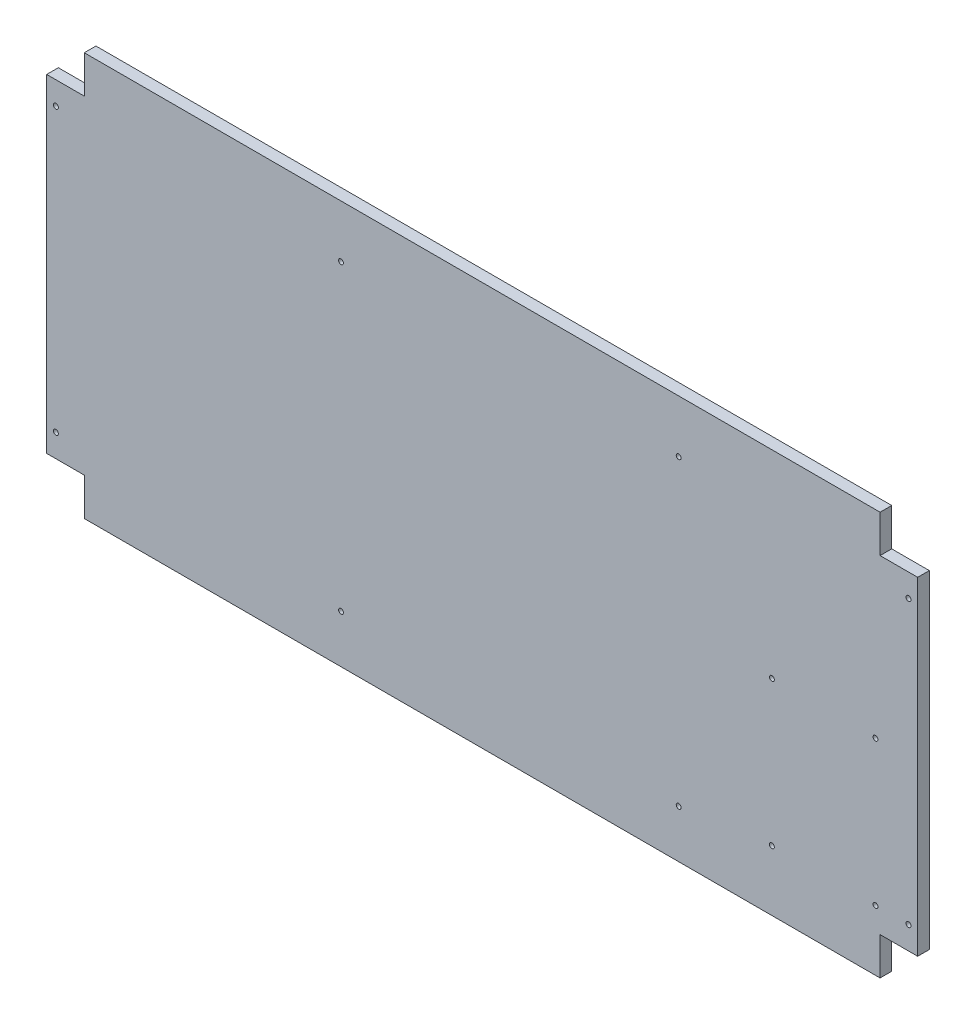
from build123d import *

# Parameters (mm, degrees)
SKETCH2_W           = 950
SKETCH2_H           = 440
BOSS_EXTRUDE1_DEPTH = 12.7
CUT_EXTRUDE1_REACH  = 525.628
SKETCH3_W           = 41
SKETCH3_H           = 41
CUT_EXTRUDE2_REACH  = 525.628
SKETCH4_R           = 2.75
CUT_EXTRUDE3_REACH  = 525.628
SKETCH6_R           = 2.665
CUT_EXTRUDE4_REACH  = 525.628
SKETCH7_R           = 2.665


with BuildPart() as part:
    # Sketch2 → Boss-Extrude1 (new body)
    with BuildSketch(Plane.XY):
        Rectangle(SKETCH2_W, SKETCH2_H)
    extrude(amount=BOSS_EXTRUDE1_DEPTH)

    # Sketch3 → Cut-Extrude1 (cut, up to next)
    with BuildSketch(Plane.XY.offset(12.7), mode=Mode.PRIVATE) as cut_extrude1_sk1:
        with Locations((-454.5, 199.5)):
            Rectangle(SKETCH3_W, SKETCH3_H)
    cut_extrude1_tool1 = extrude(cut_extrude1_sk1.sketch, amount=-CUT_EXTRUDE1_REACH, mode=Mode.PRIVATE) & part.part
    # Sketch3 → Cut-Extrude1 (cut, up to next)
    with BuildSketch(Plane.XY.offset(12.7), mode=Mode.PRIVATE) as cut_extrude1_sk2:
        with Locations((454.5, 199.5)):
            Rectangle(SKETCH3_W, SKETCH3_H)
    cut_extrude1_tool2 = extrude(cut_extrude1_sk2.sketch, amount=-CUT_EXTRUDE1_REACH, mode=Mode.PRIVATE) & part.part
    # Sketch3 → Cut-Extrude1 (cut, up to next)
    with BuildSketch(Plane.XY.offset(12.7), mode=Mode.PRIVATE) as cut_extrude1_sk3:
        with Locations((454.5, -199.5)):
            Rectangle(SKETCH3_W, SKETCH3_H)
    cut_extrude1_tool3 = extrude(cut_extrude1_sk3.sketch, amount=-CUT_EXTRUDE1_REACH, mode=Mode.PRIVATE) & part.part
    # Sketch3 → Cut-Extrude1 (cut, up to next)
    with BuildSketch(Plane.XY.offset(12.7), mode=Mode.PRIVATE) as cut_extrude1_sk4:
        with Locations((-454.5, -199.5)):
            Rectangle(SKETCH3_W, SKETCH3_H)
    cut_extrude1_tool4 = extrude(cut_extrude1_sk4.sketch, amount=-CUT_EXTRUDE1_REACH, mode=Mode.PRIVATE) & part.part
    add(cut_extrude1_tool1.solids().sort_by_distance((-454.5, 199.5, 12.7))[0], mode=Mode.SUBTRACT)
    add(cut_extrude1_tool2.solids().sort_by_distance((454.5, 199.5, 12.7))[0], mode=Mode.SUBTRACT)
    add(cut_extrude1_tool3.solids().sort_by_distance((454.5, -199.5, 12.7))[0], mode=Mode.SUBTRACT)
    add(cut_extrude1_tool4.solids().sort_by_distance((-454.5, -199.5, 12.7))[0], mode=Mode.SUBTRACT)

    # Sketch4 → Cut-Extrude2 (cut, up to next)
    with BuildSketch(Plane.XY.offset(12.7), mode=Mode.PRIVATE) as cut_extrude2_sk1:
        with Locations((-465, -154)):
            Circle(SKETCH4_R)
    cut_extrude2_tool1 = extrude(cut_extrude2_sk1.sketch, amount=-CUT_EXTRUDE2_REACH, mode=Mode.PRIVATE) & part.part
    # Sketch4 → Cut-Extrude2 (cut, up to next)
    with BuildSketch(Plane.XY.offset(12.7), mode=Mode.PRIVATE) as cut_extrude2_sk2:
        with Locations(Location((-465, 154, 0), (0, 0, 180))):
            Circle(SKETCH4_R)
    cut_extrude2_tool2 = extrude(cut_extrude2_sk2.sketch, amount=-CUT_EXTRUDE2_REACH, mode=Mode.PRIVATE) & part.part
    # Sketch4 → Cut-Extrude2 (cut, up to next)
    with BuildSketch(Plane.XY.offset(12.7), mode=Mode.PRIVATE) as cut_extrude2_sk3:
        with Locations(Location((465, -154, 0), (0, 0, 180))):
            Circle(SKETCH4_R)
    cut_extrude2_tool3 = extrude(cut_extrude2_sk3.sketch, amount=-CUT_EXTRUDE2_REACH, mode=Mode.PRIVATE) & part.part
    # Sketch4 → Cut-Extrude2 (cut, up to next)
    with BuildSketch(Plane.XY.offset(12.7), mode=Mode.PRIVATE) as cut_extrude2_sk4:
        with Locations((465, 154)):
            Circle(SKETCH4_R)
    cut_extrude2_tool4 = extrude(cut_extrude2_sk4.sketch, amount=-CUT_EXTRUDE2_REACH, mode=Mode.PRIVATE) & part.part
    add(cut_extrude2_tool1.solids().sort_by_distance((-465, -154, 12.7))[0], mode=Mode.SUBTRACT)
    add(cut_extrude2_tool2.solids().sort_by_distance((-465, 154, 12.7))[0], mode=Mode.SUBTRACT)
    add(cut_extrude2_tool3.solids().sort_by_distance((465, -154, 12.7))[0], mode=Mode.SUBTRACT)
    add(cut_extrude2_tool4.solids().sort_by_distance((465, 154, 12.7))[0], mode=Mode.SUBTRACT)

    # Sketch6 → Cut-Extrude3 (cut, up to next)
    with BuildSketch(Plane.XY.offset(12.7), mode=Mode.PRIVATE) as cut_extrude3_sk1:
        with Locations((-153.985226099, -167.605059616)):
            Circle(SKETCH6_R)
    cut_extrude3_tool1 = extrude(cut_extrude3_sk1.sketch, amount=-CUT_EXTRUDE3_REACH, mode=Mode.PRIVATE) & part.part
    # Sketch6 → Cut-Extrude3 (cut, up to next)
    with BuildSketch(Plane.XY.offset(12.7), mode=Mode.PRIVATE) as cut_extrude3_sk2:
        with Locations((214.314773901, -167.605059616)):
            Circle(SKETCH6_R)
    cut_extrude3_tool2 = extrude(cut_extrude3_sk2.sketch, amount=-CUT_EXTRUDE3_REACH, mode=Mode.PRIVATE) & part.part
    # Sketch6 → Cut-Extrude3 (cut, up to next)
    with BuildSketch(Plane.XY.offset(12.7), mode=Mode.PRIVATE) as cut_extrude3_sk3:
        with Locations((214.314773901, 162.594940384)):
            Circle(SKETCH6_R)
    cut_extrude3_tool3 = extrude(cut_extrude3_sk3.sketch, amount=-CUT_EXTRUDE3_REACH, mode=Mode.PRIVATE) & part.part
    # Sketch6 → Cut-Extrude3 (cut, up to next)
    with BuildSketch(Plane.XY.offset(12.7), mode=Mode.PRIVATE) as cut_extrude3_sk4:
        with Locations((-153.985226099, 162.594940384)):
            Circle(SKETCH6_R)
    cut_extrude3_tool4 = extrude(cut_extrude3_sk4.sketch, amount=-CUT_EXTRUDE3_REACH, mode=Mode.PRIVATE) & part.part
    add(cut_extrude3_tool1.solids().sort_by_distance((-153.985226, -167.60506, 12.7))[0], mode=Mode.SUBTRACT)
    add(cut_extrude3_tool2.solids().sort_by_distance((214.314774, -167.60506, 12.7))[0], mode=Mode.SUBTRACT)
    add(cut_extrude3_tool3.solids().sort_by_distance((214.314774, 162.59494, 12.7))[0], mode=Mode.SUBTRACT)
    add(cut_extrude3_tool4.solids().sort_by_distance((-153.985226, 162.59494, 12.7))[0], mode=Mode.SUBTRACT)

    # Sketch7 → Cut-Extrude4 (cut, up to next)
    with BuildSketch(Plane.XY.offset(12.7), mode=Mode.PRIVATE) as cut_extrude4_sk1:
        with Locations((429, 4)):
            Circle(SKETCH7_R)
    cut_extrude4_tool1 = extrude(cut_extrude4_sk1.sketch, amount=-CUT_EXTRUDE4_REACH, mode=Mode.PRIVATE) & part.part
    # Sketch7 → Cut-Extrude4 (cut, up to next)
    with BuildSketch(Plane.XY.offset(12.7), mode=Mode.PRIVATE) as cut_extrude4_sk2:
        with Locations((429, -154)):
            Circle(SKETCH7_R)
    cut_extrude4_tool2 = extrude(cut_extrude4_sk2.sketch, amount=-CUT_EXTRUDE4_REACH, mode=Mode.PRIVATE) & part.part
    # Sketch7 → Cut-Extrude4 (cut, up to next)
    with BuildSketch(Plane.XY.offset(12.7), mode=Mode.PRIVATE) as cut_extrude4_sk3:
        with Locations((316, 4)):
            Circle(SKETCH7_R)
    cut_extrude4_tool3 = extrude(cut_extrude4_sk3.sketch, amount=-CUT_EXTRUDE4_REACH, mode=Mode.PRIVATE) & part.part
    # Sketch7 → Cut-Extrude4 (cut, up to next)
    with BuildSketch(Plane.XY.offset(12.7), mode=Mode.PRIVATE) as cut_extrude4_sk4:
        with Locations((316, -154)):
            Circle(SKETCH7_R)
    cut_extrude4_tool4 = extrude(cut_extrude4_sk4.sketch, amount=-CUT_EXTRUDE4_REACH, mode=Mode.PRIVATE) & part.part
    add(cut_extrude4_tool1.solids().sort_by_distance((429, 4, 12.7))[0], mode=Mode.SUBTRACT)
    add(cut_extrude4_tool2.solids().sort_by_distance((429, -154, 12.7))[0], mode=Mode.SUBTRACT)
    add(cut_extrude4_tool3.solids().sort_by_distance((316, 4, 12.7))[0], mode=Mode.SUBTRACT)
    add(cut_extrude4_tool4.solids().sort_by_distance((316, -154, 12.7))[0], mode=Mode.SUBTRACT)


solid = part.part
